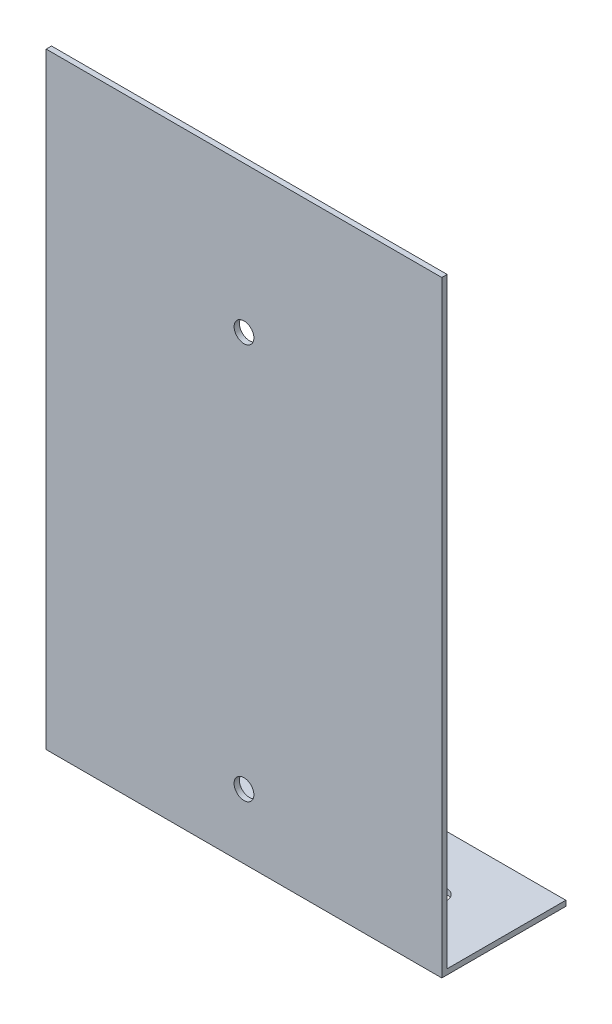
from build123d import *

# Parameters (mm, degrees)
SKETCH1_W           = 200
SKETCH1_H           = 60
SKETCH1_R           = 5
BOSS_EXTRUDE1_DEPTH = 2.7
SKETCH2_W           = 200
SKETCH2_H           = 306.7
SKETCH2_R           = 5
BOSS_EXTRUDE2_DEPTH = 2.7


with BuildPart() as part:
    # Sketch1 → Boss-Extrude1 (new body)
    with BuildSketch(Plane(origin=(0, 0, 0), x_dir=(1, 0, 0), z_dir=(0, 1, 0))):
        with Locations((100, 30)):
            Rectangle(SKETCH1_W, SKETCH1_H)
        with Locations(Location((35, 30, 0), (0, 0, 90))):
            Circle(SKETCH1_R, mode=Mode.SUBTRACT)
        with Locations(Location((165, 30, 0), (0, 0, 90))):
            Circle(SKETCH1_R, mode=Mode.SUBTRACT)
    extrude(amount=BOSS_EXTRUDE1_DEPTH)

    # Sketch2 → Boss-Extrude2 (add)
    with BuildSketch(Plane.XY):
        with Locations((100, 153.35)):
            Rectangle(SKETCH2_W, SKETCH2_H)
        with Locations(Location((100, 32.7, 0), (0, 0, 180))):
            Circle(SKETCH2_R, mode=Mode.SUBTRACT)
        with Locations(Location((100, 232.7, 0), (0, 0, 180))):
            Circle(SKETCH2_R, mode=Mode.SUBTRACT)
    extrude(amount=BOSS_EXTRUDE2_DEPTH)


solid = part.part
